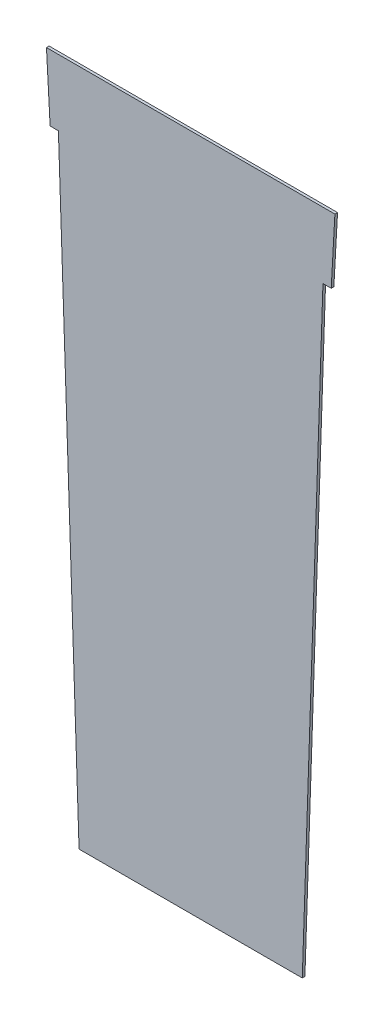
from build123d import *

# Parameters (mm, degrees)
BOSS_EXTRUDE1_DEPTH = 2.032


with BuildPart() as part:
    # Sketch1 → Boss-Extrude1 (new body)
    with BuildSketch(Plane.XY):
        Polygon((221.544444444, 0), (218.722222222, -50.8), (2.822222222, -50.8), (0, 0), align=None)
        Polygon((212.372222222, -50.8), (9.172222222, -50.8), (25.047222222, -520.7), (196.497222222, -520.7), align=None)
    extrude(amount=BOSS_EXTRUDE1_DEPTH)


solid = part.part
